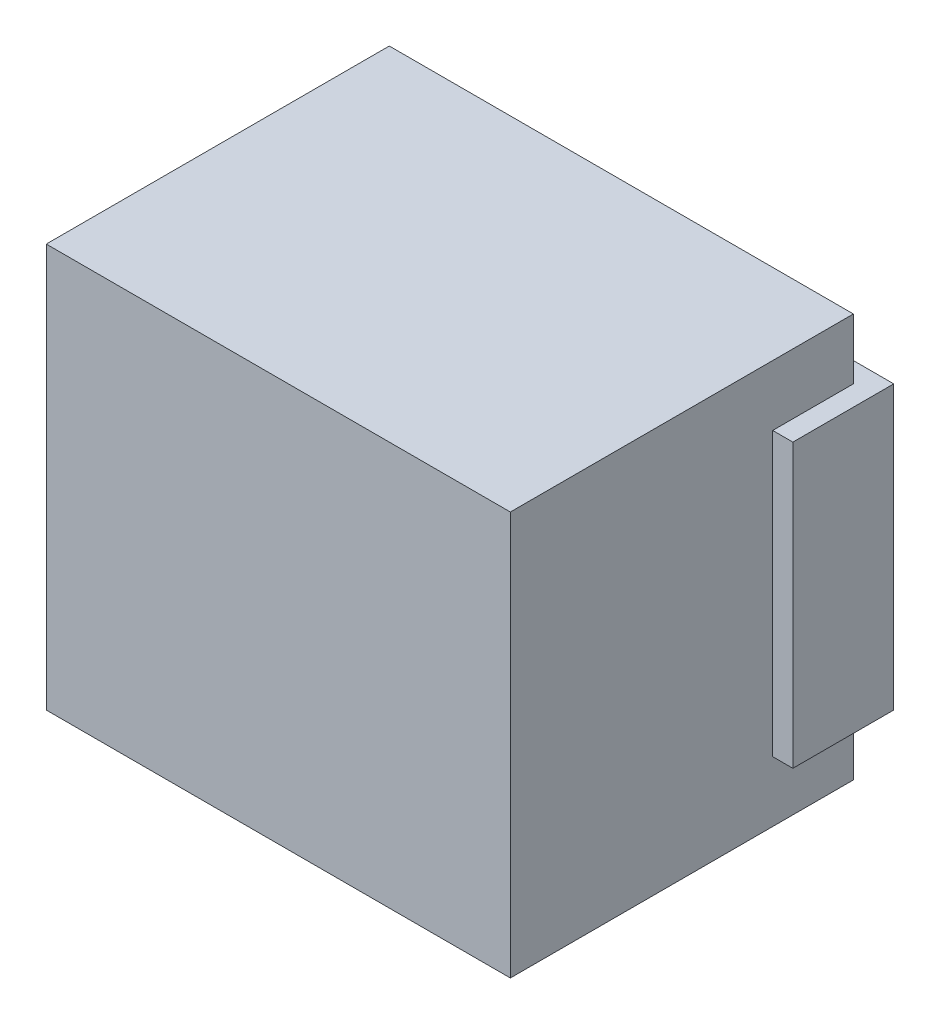
from build123d import *

# Parameters (mm, degrees)
SKETCH1_W           = 2.3
SKETCH1_H           = 1.7
BOSS_EXTRUDE1_DEPTH = 1
BOSS_EXTRUDE2_DEPTH = 0.7


with BuildPart() as part:
    # Sketch1 → Boss-Extrude1 (new, symmetric)
    with BuildSketch(Plane(origin=(0, 0, 0), x_dir=(1, 0, 0), z_dir=(0, 1, 0))):
        with Locations((0, -0.95)):
            Rectangle(SKETCH1_W, SKETCH1_H)
    extrude(amount=BOSS_EXTRUDE1_DEPTH, both=True)

    # Sketch2 → Boss-Extrude2 (add, symmetric)
    with BuildSketch(Plane(origin=(0, 0, 0), x_dir=(1, 0, 0), z_dir=(0, 1, 0))):
        Polygon((-1.15, -0.5), (-1.25, -0.5), (-1.25, 0), (-0.85, 0), (-0.85, -0.1), (-1.15, -0.1), align=None)
        Polygon((1.15, -0.1), (1.15, -0.5), (1.25, -0.5), (1.25, 0), (0.85, 0), (0.85, -0.1), align=None)
    extrude(amount=BOSS_EXTRUDE2_DEPTH, both=True)


solid = part.part
